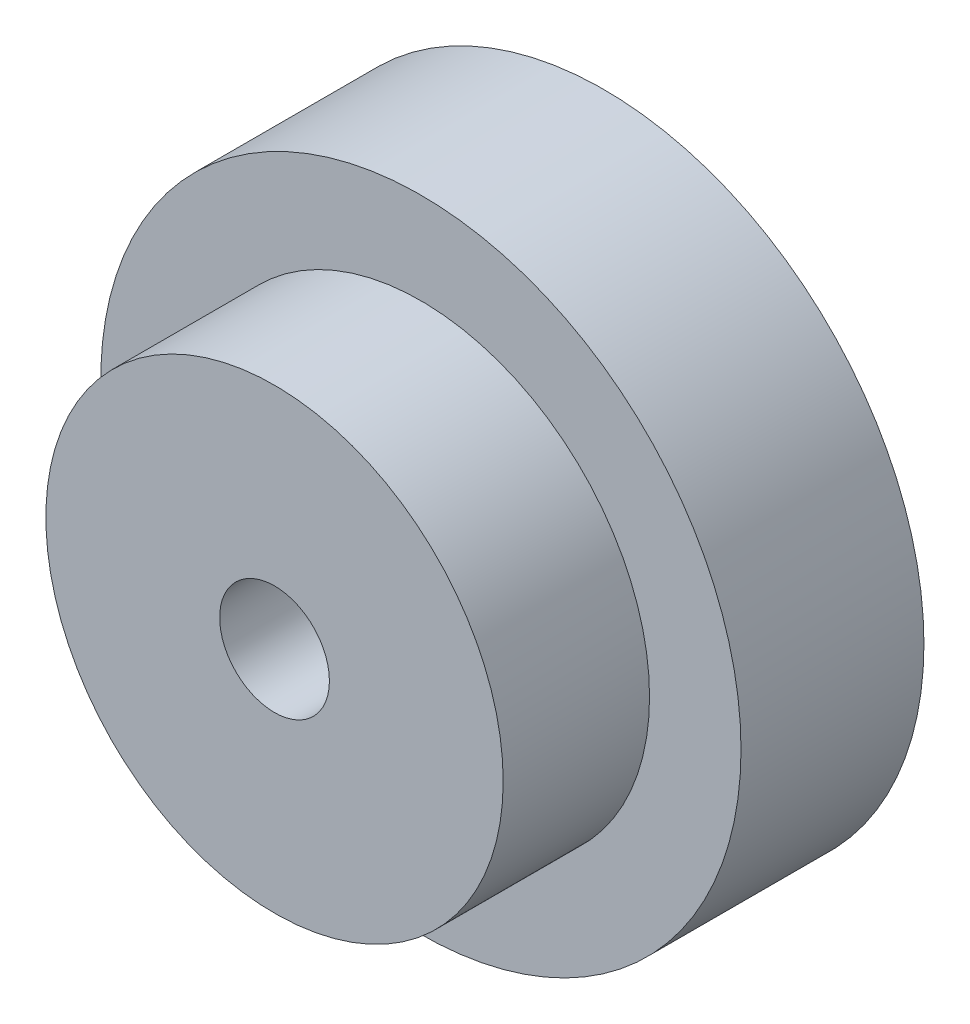
from build123d import *

# Parameters (mm, degrees)
SKETCH_1_R      = 17.5
SKETCH_1_R_2    = 3
EXTRUDE_1_DEPTH = 10
SKETCH_2_R      = 12.5
SKETCH_2_R_2    = 3
EXTRUDE_2_DEPTH = 8


with BuildPart() as part:
    # 草图1 → 凸台-拉伸1 (new body)
    with BuildSketch(Plane.XY):
        Circle(SKETCH_1_R)
        Circle(SKETCH_1_R_2, mode=Mode.SUBTRACT)
    extrude(amount=EXTRUDE_1_DEPTH)

    # 草图2 → 凸台-拉伸2 (add)
    with BuildSketch(Plane.XY.offset(10)):
        Circle(SKETCH_2_R)
        Circle(SKETCH_2_R_2, mode=Mode.SUBTRACT)
    extrude(amount=EXTRUDE_2_DEPTH)


solid = part.part
